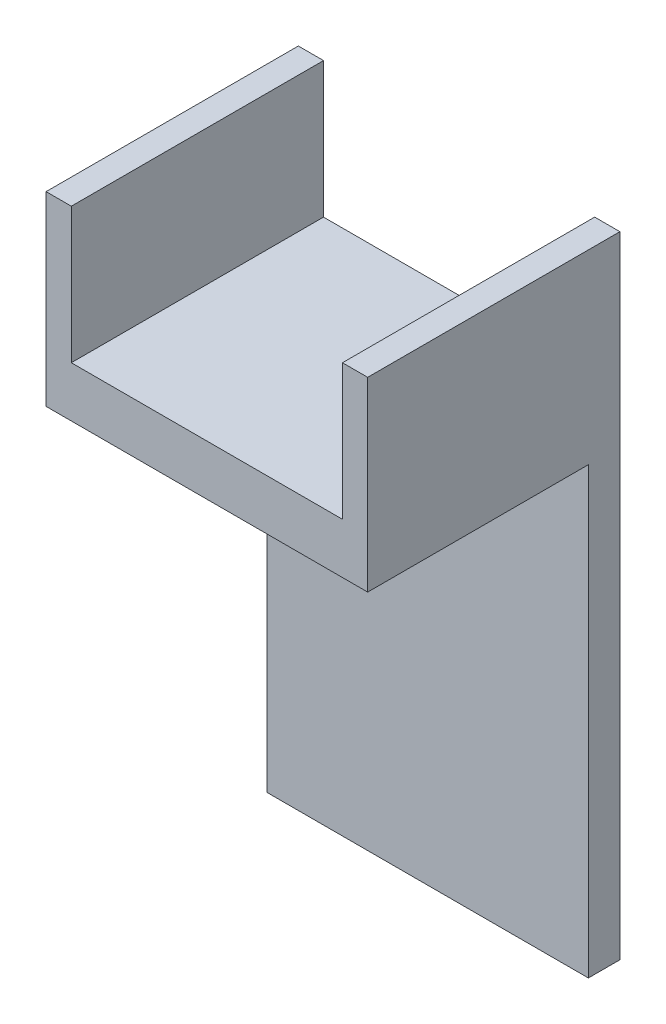
from build123d import *

# Parameters (mm, degrees)
EXTRUDE_1_DEPTH     = 5
EXTRUDE_2_DEPTH     = 5
CUT_EXTRUDE_2_DEPTH = 52
SKETCH_6_W          = 43
SKETCH_6_H          = 8
EXTRUDE_3_DEPTH     = 35
RIB_4_REACH         = 262.096
SKETCH_8_WALL_W     = 562.75395357
SKETCH_8_WALL_H     = 10
CUT_EXTRUDE_3_DEPTH = 35
SKETCH_10_W         = 141.906690428
SKETCH_10_H         = 100
CUT_EXTRUDE_4_DEPTH = 10


with BuildPart() as part:
    # 草图1 → 凸台-拉伸1 (new body)
    with BuildSketch(Plane.XY):
        with BuildLine():
            Line((167.406690428, -100), (0, -100))
            Line((0, -100), (-167.406690428, -100))
            ThreePointArc((-167.406690428, -100), (0, -195), (167.406690428, -100))
        make_face()
    extrude(amount=EXTRUDE_1_DEPTH)

    # 草图4 → 凸台-拉伸2 (add)
    with BuildSketch(Plane.XY.offset(5)):
        Polygon((167.406690428, 0), (0, 0), (0, -100), (21.5, -100), (167.406690428, -100), align=None)
        Polygon((0, -100), (0, 0), (-167.406690428, 0), (-167.406690428, -100), (-21.5, -100), align=None)
    extrude(amount=-EXTRUDE_2_DEPTH)

    # 草图5 → 切除-拉伸2 (cut)
    with BuildSketch(Plane.XY.offset(5)):
        Polygon((0, 0), (21.5, 0), (21.5, -21.5), (-21.5, -21.5), (-21.5, 0), align=None)
    extrude(amount=-CUT_EXTRUDE_2_DEPTH, mode=Mode.SUBTRACT)

    # 草图6 → 凸台-拉伸3 (add)
    with BuildSketch(Plane.XY.offset(5)):
        Polygon((-21.5, -29.5), (-21.5, -21.5), (-21.5, 0), (-25.5, 0), (-25.5, -29.5), align=None)
        with Locations((0, -25.5)):
            Rectangle(SKETCH_6_W, SKETCH_6_H)
        Polygon((21.5, 0), (21.5, -21.5), (21.5, -29.5), (25.5, -29.5), (25.5, 0), align=None)
    extrude(amount=EXTRUDE_3_DEPTH)

    # 草图8 wall → 筋4 (add, up to next)
    with BuildSketch(Plane(origin=(0, -39.75, 22.5), x_dir=(0, -0.505403111507, -0.862883361109), z_dir=(0, 0.862883361109, -0.505403111507)), mode=Mode.PRIVATE) as rib_4_sk1:
        Rectangle(SKETCH_8_WALL_W, SKETCH_8_WALL_H)
    rib_4_tool1 = extrude(rib_4_sk1.sketch, amount=RIB_4_REACH, mode=Mode.PRIVATE) - part.part
    add(rib_4_tool1.solids().sort_by_distance((0, -39.75, 22.5))[0])

    # 草图9 → 切除-拉伸3 (cut)
    with BuildSketch(Plane(origin=(0, 0, 0), x_dir=(-1, 0, 0), z_dir=(0, 0, -1))):
        Polygon((-167.406690428, -100), (167.406690428, -100), (167.406690428, -206.368717501), (-177.688477613, -206.368717501), align=None)
    extrude(amount=-CUT_EXTRUDE_3_DEPTH, mode=Mode.SUBTRACT)

    # 草图10 → 切除-拉伸4 (cut)
    with BuildSketch(Plane(origin=(0, 0, 0), x_dir=(-1, 0, 0), z_dir=(0, 0, -1))):
        with Locations((-96.453345214, -50)):
            Rectangle(SKETCH_10_W, SKETCH_10_H)
        with Locations((96.453345214, -50)):
            Rectangle(SKETCH_10_W, SKETCH_10_H)
    extrude(amount=-CUT_EXTRUDE_4_DEPTH, mode=Mode.SUBTRACT)


solid = part.part
